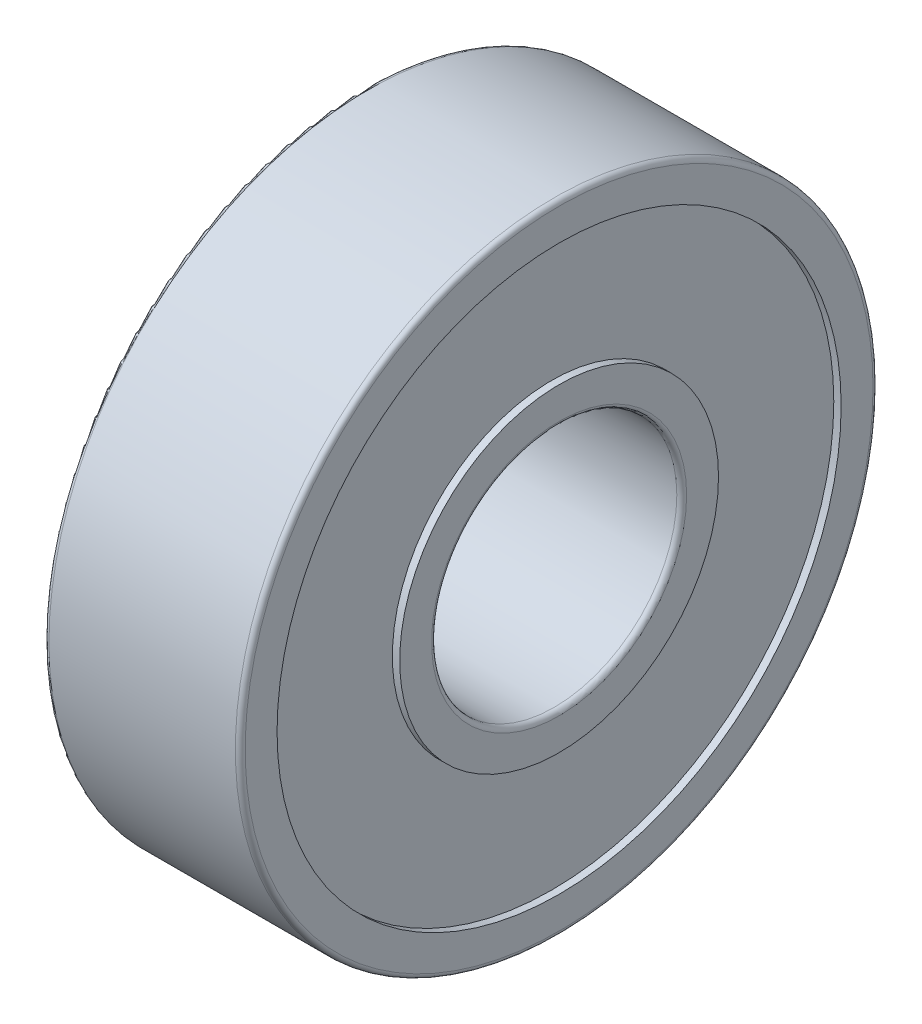
from build123d import *

# Parameters (mm, degrees)
FILLET1_R = 0.2


with BuildPart() as part:
    # Sketch1 → Revolve1 (revolve)
    with BuildSketch(Plane.XY, mode=Mode.PRIVATE) as revolve1_sk:
        Polygon((4, 5), (-4, 5), (-4, 6.5), (-3.7, 6.5), (-3.7, 11.5), (-4, 11.5), (-4, 13), (4, 13), (4, 11.5), (3.7, 11.5), (3.7, 6.5), (4, 6.5), align=None)
    revolve(revolve1_sk.sketch.rotate(Axis((0, 0, 0), (-1, 0, 0)), 90), axis=Axis((0, 0, 0), (-1, 0, 0)))

    # Fillet1
    fillet1_edges = [part.edges().sort_by_distance(p)[0] for p in [
        (4, 0, 13),
        (-4, 0, 13),
        (-4, 0, 5),
        (4, 0, 5),
    ]]
    fillet(fillet1_edges, radius=FILLET1_R)


solid = part.part
